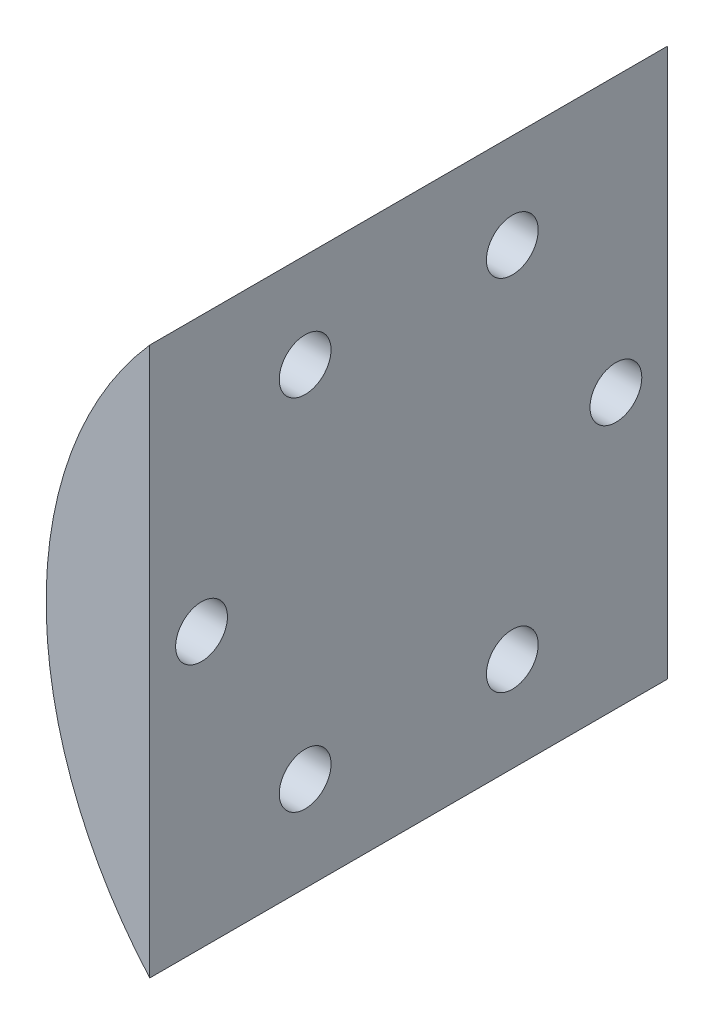
from build123d import *

# Parameters (mm, degrees)
BOSS_EXTRUDE1_DEPTH = 50
SKETCH3_R           = 2.5
CUT_EXTRUDE1_DEPTH  = 58.445626465


with BuildPart() as part:
    # Sketch2 → Boss-Extrude1 (new body)
    with BuildSketch(Plane.XY):
        with BuildLine():
            Line((-30, 26.457513111), (-30, -26.457513111))
            ThreePointArc((-30, -26.457513111), (-40, 0), (-30, 26.457513111))
        make_face()
    extrude(amount=BOSS_EXTRUDE1_DEPTH)

    # Sketch3 → Cut-Extrude1 (cut, through all)
    with BuildSketch(Plane(origin=(-30, 0, 0), x_dir=(0, 0, -1), z_dir=(1, 0, 0))):
        with Locations((-5, 0)):
            Circle(SKETCH3_R)
        with Locations((-15, -17.320508076)):
            Circle(SKETCH3_R)
        with Locations((-35, -17.320508076)):
            Circle(SKETCH3_R)
        with Locations((-45, 0)):
            Circle(SKETCH3_R)
        with Locations((-35, 17.320508076)):
            Circle(SKETCH3_R)
        with Locations((-15, 17.320508076)):
            Circle(SKETCH3_R)
    extrude(amount=-CUT_EXTRUDE1_DEPTH, mode=Mode.SUBTRACT)


solid = part.part
